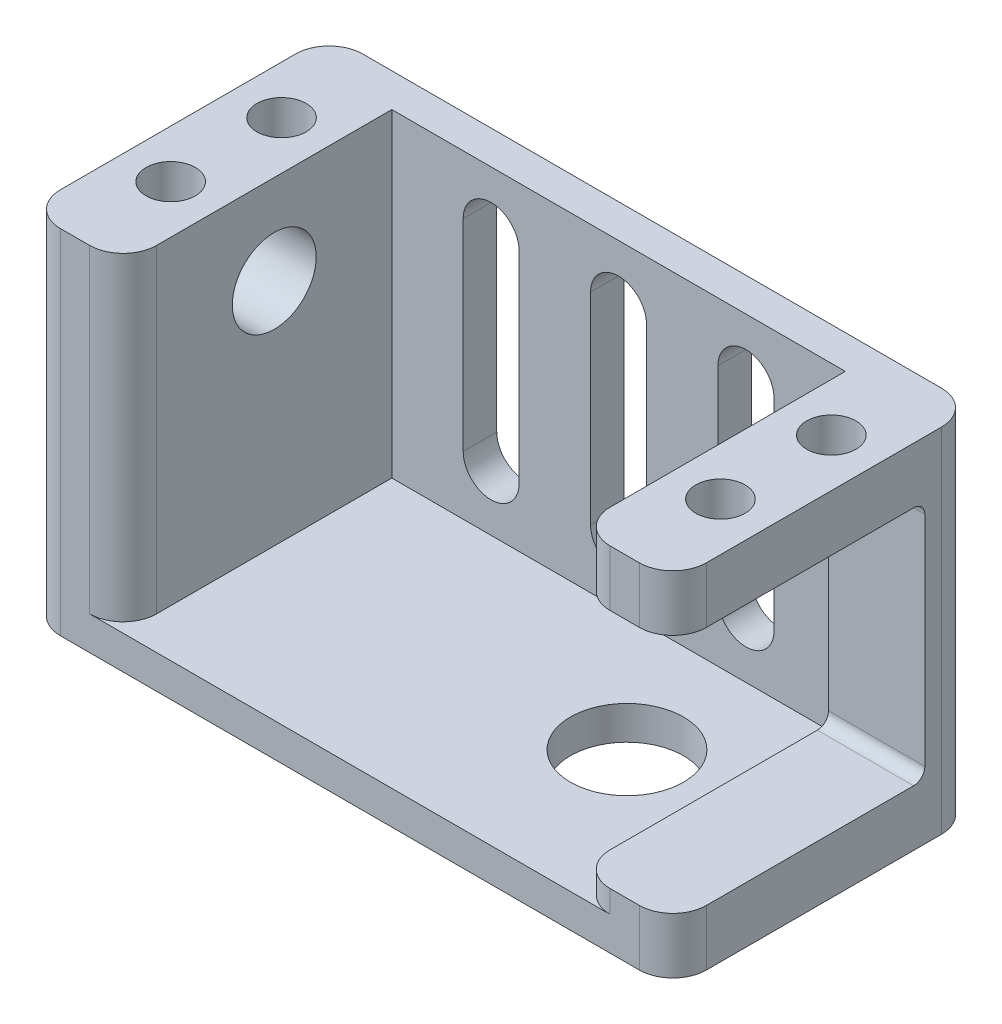
from build123d import *

# Parameters (mm, degrees)
SKETCH1_W           = 8.6
SKETCH1_H           = 27.000000000000004
BOSS_EXTRUDE1_DEPTH = 31.5
SKETCH2_W           = 27
SKETCH2_H           = 3
BOSS_EXTRUDE2_DEPTH = 40.5
BOSS_EXTRUDE3_DEPTH = 40.5
BOSS_EXTRUDE4_DEPTH = 31.5
CUT_EXTRUDE6_DEPTH  = 67.48165160403282
SKETCH5_R           = 2.200000000000013
SKETCH5_R_2         = 2.200000000000042
SKETCH5_R_3         = 2.2000000000000135
SKETCH5_R_4         = 2.2000000000000384
CUT_EXTRUDE1_DEPTH  = 5
CUT_EXTRUDE2_DEPTH  = 10
SKETCH8_R           = 5.050000000000001
CUT_EXTRUDE3_DEPTH  = 63.016610678107845
SKETCH9_R           = 1.7500000000000042
CUT_EXTRUDE4_DEPTH  = 8.6
SKETCH10_R          = 3.7500000000000013
CUT_EXTRUDE5_DEPTH  = 6.6
BOSS_EXTRUDE5_START = 2
BOSS_EXTRUDE5_DEPTH = 2
FILLET1_R           = 3
FILLET2_R           = 3
FILLET3_R           = 1
FILLET4_R           = 0.25
FILLET5_R           = 1.5


with BuildPart() as part:
    # Sketch1 → Boss-Extrude1 (new body)
    with BuildSketch(Plane(origin=(0, 0, 0), x_dir=(1, 0, 0), z_dir=(0, 1, 0))):
        Rectangle(SKETCH1_W, SKETCH1_H)
    extrude(amount=BOSS_EXTRUDE1_DEPTH)

    # Sketch2 → Boss-Extrude2 (add)
    with BuildSketch(Plane(origin=(4.3, 0, 0), x_dir=(0, 0, -1), z_dir=(1, 0, 0))):
        with Locations((-1.78e-15, 1.5)):
            Rectangle(SKETCH2_W, SKETCH2_H)
    extrude(amount=BOSS_EXTRUDE2_DEPTH)

    # Sketch3 → Boss-Extrude3 (add)
    with BuildSketch(Plane(origin=(4.3, 0, 0), x_dir=(0, 0, -1), z_dir=(1, 0, 0))):
        Polygon((10.499999999999998, 31.5), (10.500000000000002, 2.9999999999999996), (13.499999999999998, 3), (13.499999999999998, 31.5), align=None)
    extrude(amount=BOSS_EXTRUDE3_DEPTH)

    # Sketch4 → Boss-Extrude4 (add)
    with BuildSketch(Plane(origin=(0, 31.5, 0), x_dir=(1, 0, 0), z_dir=(0, 1, 0))):
        Polygon((44.8, 13.499999999999998), (44.8, -13.5), (53.4, -13.5), (53.4, 13.500000000000004), align=None)
    extrude(amount=-BOSS_EXTRUDE4_DEPTH)

    # Sketch12 → Cut-Extrude6 (cut, through all)
    with BuildSketch(Plane.XY.offset(-10.500000000000002)):
        with BuildLine():
            Line((38.43, 8.25), (38.43, 26.249999999999996))
            ThreePointArc((38.43, 26.249999999999996), (35.93, 28.750000000000004), (33.42999999999999, 26.249999999999996))
            Line((33.42999999999999, 26.249999999999996), (33.42999999999999, 8.25))
            ThreePointArc((33.42999999999999, 8.25), (35.93000000000001, 5.750000000000007), (38.43, 8.25))
        make_face()
        with BuildLine():
            Line((27.049999999999997, 8.25), (27.049999999999997, 26.249999999999996))
            ThreePointArc((27.049999999999997, 26.249999999999996), (24.55, 28.75), (22.049999999999994, 26.249999999999996))
            Line((22.049999999999994, 26.249999999999996), (22.049999999999994, 8.25))
            ThreePointArc((22.049999999999994, 8.25), (24.55, 5.7500000000000036), (27.049999999999997, 8.25))
        make_face()
        with BuildLine():
            Line((15.670000000000003, 8.250000000000014), (15.670000000000003, 26.25))
            ThreePointArc((15.670000000000003, 26.25), (13.170000000000002, 28.75000000000001), (10.669999999999998, 26.25))
            Line((10.669999999999998, 26.25), (10.669999999999998, 8.250000000000014))
            ThreePointArc((10.669999999999998, 8.250000000000014), (13.169999999999995, 5.750000000000018), (15.670000000000003, 8.250000000000014))
        make_face()
    extrude(amount=-CUT_EXTRUDE6_DEPTH, mode=Mode.SUBTRACT)

    # Sketch5 → Cut-Extrude1 (cut)
    with BuildSketch(Plane(origin=(0, 31.5, 0), x_dir=(1, 0, 0), z_dir=(0, 1, 0))):
        with Locations(Location((49.099999999999994, 4.95, 0), (0, 0, 270))):
            Circle(SKETCH5_R)
        with Locations(Location((49.099999999999994, -4.949999999999998, 0), (0, 0, 270))):
            Circle(SKETCH5_R_2)
        with Locations(Location((0, 4.949999999999999, 0), (0, 0, 270))):
            Circle(SKETCH5_R_3)
        with Locations(Location((0, -4.949999999999999, 0), (0, 0, 270))):
            Circle(SKETCH5_R_4)
    extrude(amount=-CUT_EXTRUDE1_DEPTH, mode=Mode.SUBTRACT)

    # Sketch6 → Cut-Extrude2 (cut)
    with BuildSketch(Plane.ZY.offset(-44.8)):
        Polygon((13.5, 26.500000000000004), (13.500000000000014, 5), (-9, 4.999999999999998), (-9, 26.5), align=None)
    extrude(amount=-CUT_EXTRUDE2_DEPTH, mode=Mode.SUBTRACT)

    # Sketch8 → Cut-Extrude3 (cut, through all)
    with BuildSketch(Plane(origin=(0, 3, 0), x_dir=(1, 0, 0), z_dir=(0, 1, 0))):
        with Locations(Location((35.8, -1.75e-15, 0), (0, 0, 270))):
            Circle(SKETCH8_R)
    extrude(amount=-CUT_EXTRUDE3_DEPTH, mode=Mode.SUBTRACT)

    # Sketch9 → Cut-Extrude4 (cut)
    with BuildSketch(Plane.ZY.offset(4.3)):
        with Locations((0, 23.5)):
            Circle(SKETCH9_R)
    extrude(amount=-CUT_EXTRUDE4_DEPTH, mode=Mode.SUBTRACT)

    # Sketch10 → Cut-Extrude5 (cut)
    with BuildSketch(Plane(origin=(4.3, 0, 0), x_dir=(0, 0, -1), z_dir=(1, 0, 0))):
        with Locations((0, 23.5)):
            Circle(SKETCH10_R)
    extrude(amount=-CUT_EXTRUDE5_DEPTH, mode=Mode.SUBTRACT)

    # Sketch11 → Boss-Extrude5 (add)
    with BuildSketch(Plane.ZY.offset(4.3).offset(BOSS_EXTRUDE5_START)):
        with BuildLine():
            Line((-13.5, 21.85), (-13.5, 25.15))
            Line((-13.5, 25.15), (-0.5830951894845463, 25.15))
            ThreePointArc((-0.5830951894845463, 25.15), (-1.750000000000004, 23.5), (-0.5830951894845463, 21.85))
            Line((-0.5830951894845463, 21.85), (-13.5, 21.85))
        make_face()
    extrude(amount=-BOSS_EXTRUDE5_DEPTH)

    # Fillet1
    fillet1_edges = [part.edges().sort_by_distance(p)[0] for p in [
        (44.8, 29, 13.5),
        (53.4, 29, 13.5),
        (53.4, 15.75, -13.500000000000004),
        (53.4, 2.5, 13.5),
        (44.8, 4, 13.5),
        (4.3, 17.25, 13.5),
    ]]
    fillet(fillet1_edges, radius=FILLET1_R)

    # Fillet2
    fillet2_edges = [part.edges().sort_by_distance(p)[0] for p in [
        (-4.3, 10.925, -13.5),
        (-4.3, 15.75, 13.5),
        (-4.3, 28.325, -13.5),
    ]]
    fillet(fillet2_edges, radius=FILLET2_R)

    # Fillet3
    fillet3_edges = [part.edges().sort_by_distance(p)[0] for p in [
        (49.099999999999994, 26.5, -9.000000000000002),
        (49.099999999999994, 4.999999999999998, -9.000000000000002),
    ]]
    fillet(fillet3_edges, radius=FILLET3_R)

    # Fillet4
    fillet4_edges = [part.edges().sort_by_distance(p)[0] for p in [
        (-5.3, 25.15, -0.5830951894845464),
        (-5.3, 21.85, -0.5830951894845464),
    ]]
    fillet(fillet4_edges, radius=FILLET4_R)

    # Fillet5
    fillet5_edges = [part.edges().sort_by_distance(p)[0] for p in [
        (-6.3, 23.5, -13.5),
    ]]
    fillet(fillet5_edges, radius=FILLET5_R)


solid = part.part
